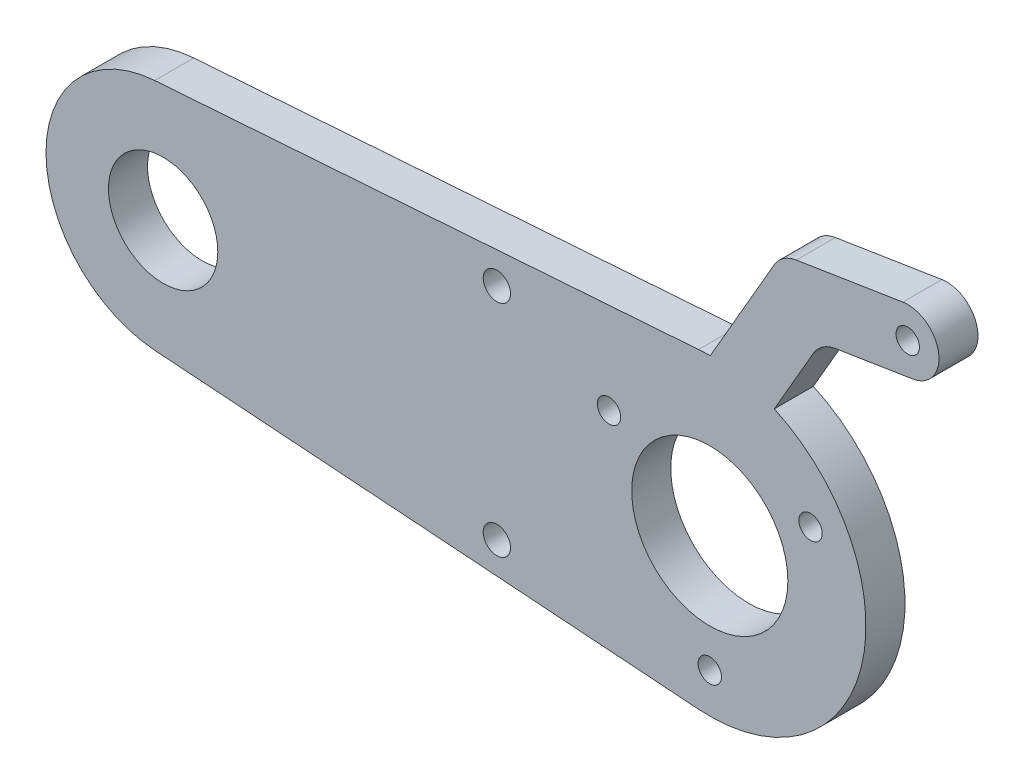
from build123d import *

# Parameters (mm, degrees)
SKETCH1_R           = 7
SKETCH1_R_2         = 10
SKETCH1_R_3         = 1.5
SKETCH1_R_4         = 1.75
BOSS_EXTRUDE1_DEPTH = 5


with BuildPart() as part:
    # Sketch1 → Boss-Extrude1 (new body)
    with BuildSketch(Plane.XY):
        with BuildLine():
            Line((-71.071428571, 14.961685761), (-1.428571429, 19.948914348))
            ThreePointArc((-1.428571429, 19.948914348), (-0.686118829, 19.988227559), (0.057281956, 19.999917969))
            Line((0.057281956, 19.999917969), (8.242983117, 34.177968276))
            ThreePointArc((8.242983117, 34.177968276), (9.441459784, 35.47447303), (11.081346872, 36.128721638))
            Line((11.081346872, 36.128721638), (24.727055657, 38.289989587))
            ThreePointArc((24.727055657, 38.289989587), (29.30354688, 34.964974085), (25.978531377, 30.388482862))
            Line((25.978531377, 30.388482862), (16.101647971, 28.824138212))
            ThreePointArc((16.101647971, 28.824138212), (14.461760884, 28.169889604), (13.263284216, 26.873384849))
            Line((13.263284216, 26.873384849), (8.263284216, 18.213130812))
            ThreePointArc((8.263284216, 18.213130812), (19.384626574, -4.923032864), (-1.428571429, -19.948914348))
            Line((-1.428571429, -19.948914348), (-71.071428571, -14.961685761))
            ThreePointArc((-71.071428571, -14.961685761), (-85, 0), (-71.071428571, 14.961685761))
        make_face()
        with Locations((-70, 0)):
            Circle(SKETCH1_R, mode=Mode.SUBTRACT)
        Circle(SKETCH1_R_2, mode=Mode.SUBTRACT)
        with Locations((-12.903778516, 7.45)):
            Circle(SKETCH1_R_3, mode=Mode.SUBTRACT)
        with Locations((0, -14.9)):
            Circle(SKETCH1_R_3, mode=Mode.SUBTRACT)
        with Locations((-27.262321561, 14.088677781)):
            Circle(SKETCH1_R_4, mode=Mode.SUBTRACT)
        with Locations((-27.262321561, -14.088677781)):
            Circle(SKETCH1_R_4, mode=Mode.SUBTRACT)
        with Locations((12.903778516, 7.45)):
            Circle(SKETCH1_R_3, mode=Mode.SUBTRACT)
        with Locations((25.352793517, 34.339236225)):
            Circle(SKETCH1_R_3, mode=Mode.SUBTRACT)
    extrude(amount=BOSS_EXTRUDE1_DEPTH)


solid = part.part
